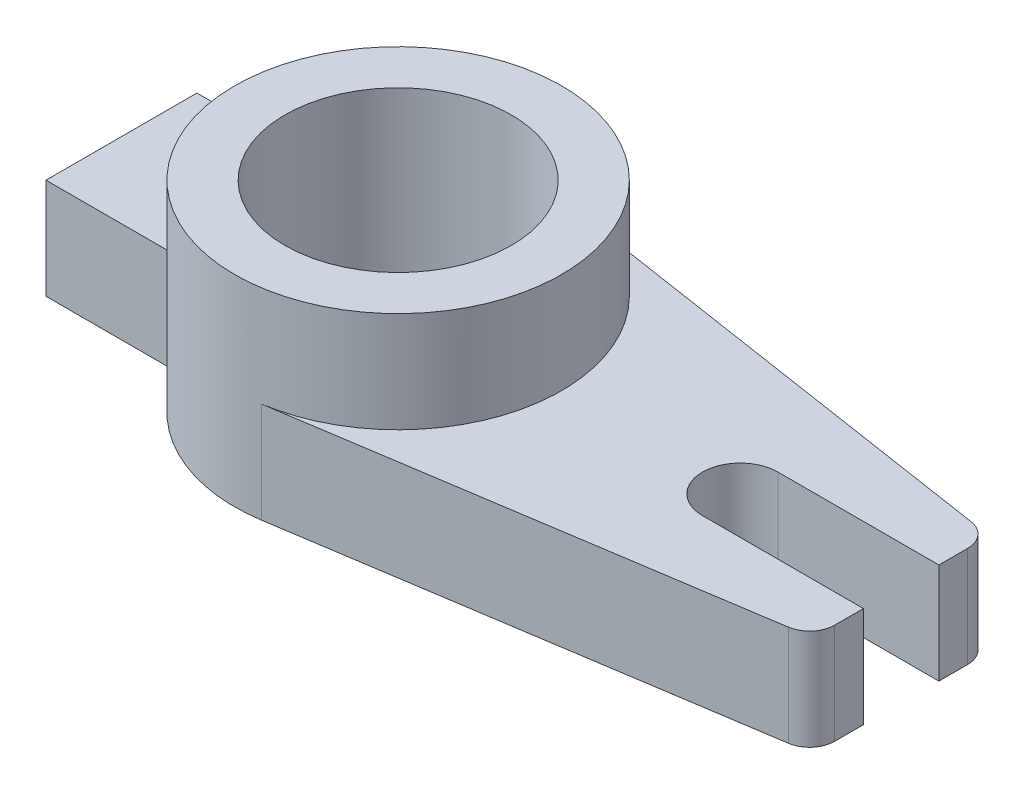
from build123d import *

# Parameters (mm, degrees)
SKETCH1_R           = 22.5
BOSS_EXTRUDE4_DEPTH = 20
SKETCH1_6_R         = 22.5
BOSS_EXTRUDE5_DEPTH = 40


with BuildPart() as part:
    # Sketch1 → Boss-Extrude4 (new body)
    with BuildSketch(Plane(origin=(0, 0, 0), x_dir=(1, 0, 0), z_dir=(0, 1, 0))):
        with BuildLine():
            Line((68, 7.5), (100, 7.5))
            Line((100, 7.5), (100, 13.210304894))
            ThreePointArc((100, 13.210304894), (98.794789747, 16.466003095), (95.760171689, 18.152180955))
            Line((95.760171689, 18.152180955), (4.941115981, 32.122194397))
            ThreePointArc((4.941115981, 32.122194397), (-14.696219934, 28.987430373), (-28.831406487, 15))
            Line((-28.831406487, 15), (-55, 15))
            Line((-55, 15), (-55, -15))
            Line((-55, -15), (-28.831406487, -15))
            ThreePointArc((-28.831406487, -15), (-14.696219934, -28.987430373), (4.941115981, -32.122194397))
            Line((4.941115981, -32.122194397), (95.760171689, -18.152180955))
            ThreePointArc((95.760171689, -18.152180955), (98.794789747, -16.466003095), (100, -13.210304894))
            Line((100, -13.210304894), (100, -7.5))
            Line((100, -7.5), (68, -7.5))
            ThreePointArc((68, -7.5), (60.5, 0), (68, 7.5))
        make_face()
        Circle(SKETCH1_R, mode=Mode.SUBTRACT)
    extrude(amount=BOSS_EXTRUDE4_DEPTH)

    # Sketch1<6> → Boss-Extrude5 (add)
    with BuildSketch(Plane(origin=(0, 0, 0), x_dir=(1, 0, 0), z_dir=(0, 1, 0))):
        with BuildLine():
            ThreePointArc((4.941115981, -32.122194397), (24.666133355, -21.162038307), (32.5, 0))
            ThreePointArc((32.5, 0), (24.666133355, 21.162038307), (4.941115981, 32.122194397))
            ThreePointArc((4.941115981, 32.122194397), (-14.696219934, 28.987430373), (-28.831406487, 15))
            ThreePointArc((-28.831406487, 15), (-32.5, 0), (-28.831406487, -15))
            ThreePointArc((-28.831406487, -15), (-14.696219934, -28.987430373), (4.941115981, -32.122194397))
        make_face()
        Circle(SKETCH1_6_R, mode=Mode.SUBTRACT)
    extrude(amount=BOSS_EXTRUDE5_DEPTH)


solid = part.part
